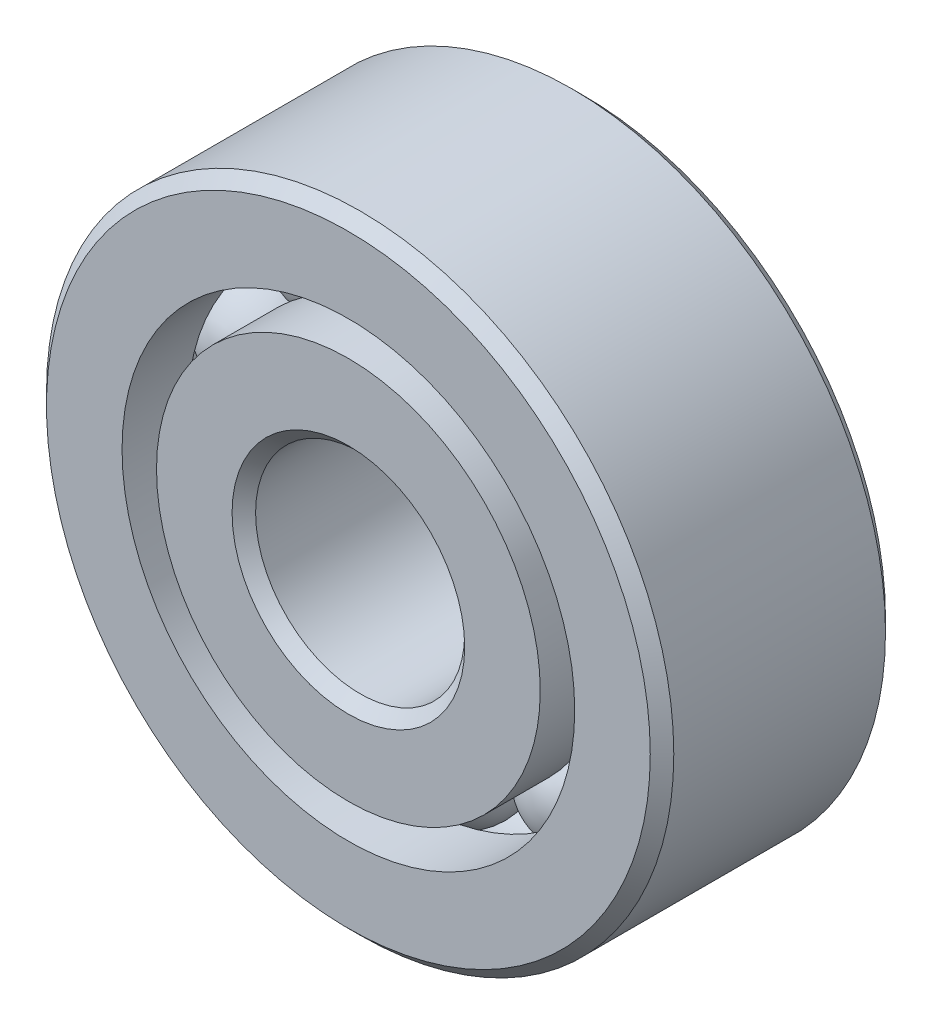
from build123d import *

# Parameters (mm, degrees)
CIRPATTERN1_COUNT = 10


with BuildPart() as part:
    # Sketch1 → Revolve1 (revolve)
    with BuildSketch(Plane(origin=(0, 0, 0), x_dir=(0, 0, -1), z_dir=(1, 0, 0))):
        with BuildLine():
            Line((3.2146875, 9.525), (-3.2146875, 9.525))
            Line((-3.2146875, 9.525), (-3.571875, 9.1678125))
            Line((-3.571875, 9.1678125), (-3.571875, 6.873351648))
            Line((-3.571875, 6.873351648), (-1.5875, 6.873351648))
            ThreePointArc((-1.5875, 6.873351648), (0, 8.021542162), (1.5875, 6.873351648))
            Line((1.5875, 6.873351648), (3.571875, 6.873351648))
            Line((3.571875, 6.873351648), (3.571875, 9.1678125))
            Line((3.571875, 9.1678125), (3.2146875, 9.525))
        make_face()
    revolve(axis=Axis((0, 0, 3.571875), (0, 0, -1)))


with BuildPart() as body_2:
    # Sketch3 → Revolve3 (revolve)
    with BuildSketch(Plane(origin=(0, 0, 0), x_dir=(0, 0, -1), z_dir=(1, 0, 0))):
        with BuildLine():
            Line((-3.571875, 5.826648352), (-1.5875, 5.826648352))
            ThreePointArc((-1.5875, 5.826648352), (0, 4.678457838), (1.5875, 5.826648352))
            Line((1.5875, 5.826648352), (3.571875, 5.826648352))
            Line((3.571875, 5.826648352), (3.571875, 3.5321875))
            Line((3.571875, 3.5321875), (3.2146875, 3.175))
            Line((3.2146875, 3.175), (-3.2146875, 3.175))
            Line((-3.2146875, 3.175), (-3.571875, 3.5321875))
            Line((-3.571875, 3.5321875), (-3.571875, 5.826648352))
        make_face()
    revolve(axis=Axis((0, 0, 3.571875), (0, 0, -1)))


with BuildPart() as body_3:
    # Sketch4 → Revolve4 (revolve)
    with BuildSketch(Plane(origin=(0, 0, 0), x_dir=(0, 0, -1), z_dir=(1, 0, 0))):
        with BuildLine():
            Line((-1.671542162, 6.35), (1.671542162, 6.35))
            ThreePointArc((1.671542162, 6.35), (0, 8.021542162), (-1.671542162, 6.35))
        make_face()
    revolve(axis=Axis((0, 6.35, 1.671542162), (0, 0, -1)))


with BuildPart() as cirpattern1_1:
    # CirPattern1: pattern copy
    add(body_3.part.rotate(Axis((0, 0, -3.571875), (0, 0, 1)), 1 * 360 / CIRPATTERN1_COUNT))


with BuildPart() as cirpattern1_2:
    # CirPattern1: pattern copy
    add(body_3.part.rotate(Axis((0, 0, -3.571875), (0, 0, 1)), 2 * 360 / CIRPATTERN1_COUNT))


with BuildPart() as cirpattern1_3:
    # CirPattern1: pattern copy
    add(body_3.part.rotate(Axis((0, 0, -3.571875), (0, 0, 1)), 3 * 360 / CIRPATTERN1_COUNT))


with BuildPart() as cirpattern1_4:
    # CirPattern1: pattern copy
    add(body_3.part.rotate(Axis((0, 0, -3.571875), (0, 0, 1)), 4 * 360 / CIRPATTERN1_COUNT))


with BuildPart() as cirpattern1_5:
    # CirPattern1: pattern copy
    add(body_3.part.rotate(Axis((0, 0, -3.571875), (0, 0, 1)), 5 * 360 / CIRPATTERN1_COUNT))


with BuildPart() as cirpattern1_6:
    # CirPattern1: pattern copy
    add(body_3.part.rotate(Axis((0, 0, -3.571875), (0, 0, 1)), 6 * 360 / CIRPATTERN1_COUNT))


with BuildPart() as cirpattern1_7:
    # CirPattern1: pattern copy
    add(body_3.part.rotate(Axis((0, 0, -3.571875), (0, 0, 1)), 7 * 360 / CIRPATTERN1_COUNT))


with BuildPart() as cirpattern1_8:
    # CirPattern1: pattern copy
    add(body_3.part.rotate(Axis((0, 0, -3.571875), (0, 0, 1)), 8 * 360 / CIRPATTERN1_COUNT))


with BuildPart() as cirpattern1_9:
    # CirPattern1: pattern copy
    add(body_3.part.rotate(Axis((0, 0, -3.571875), (0, 0, 1)), 9 * 360 / CIRPATTERN1_COUNT))


solid = Compound([part.part, body_2.part, body_3.part, cirpattern1_1.part, cirpattern1_2.part, cirpattern1_3.part, cirpattern1_4.part, cirpattern1_5.part, cirpattern1_6.part, cirpattern1_7.part, cirpattern1_8.part, cirpattern1_9.part])
